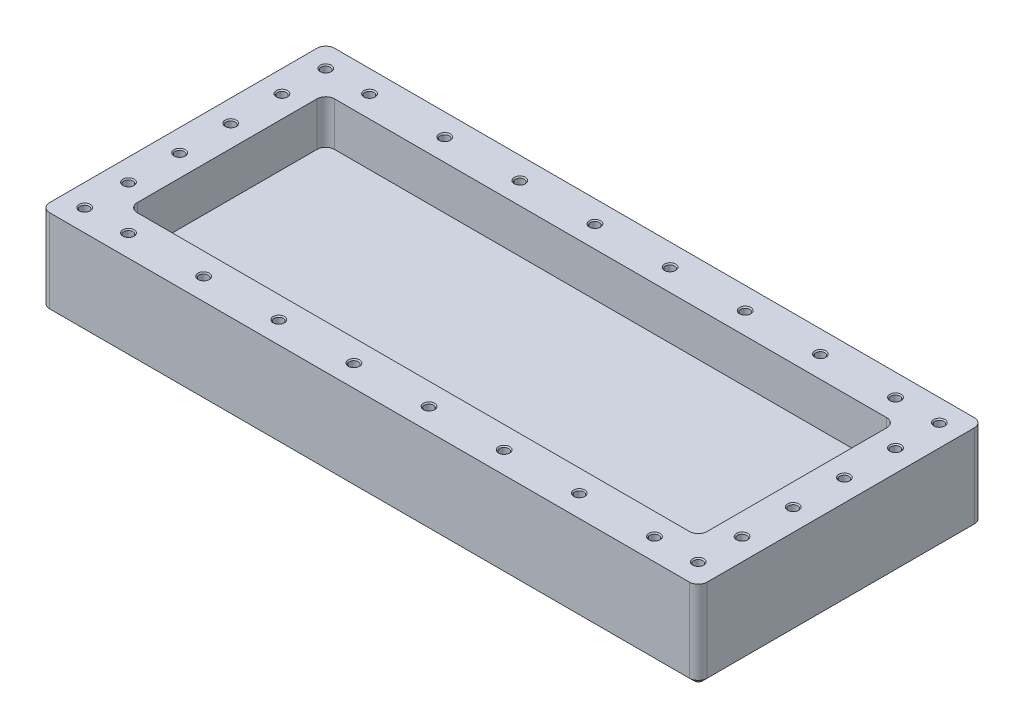
from build123d import *

# Parameters (mm, degrees)
SKETCH1_W                     = 150
SKETCH1_H                     = 65
BOSS_EXTRUDE1_DEPTH           = 20
SKETCH4_W                     = 130
SKETCH4_H                     = 45
CUT_EXTRUDE1_DEPTH            = 10
M2_5_TAPPED_HOLE1_D           = 2.05
M2_5_TAPPED_HOLE1_DEPTH       = 8
M2_5_TAPPED_HOLE1_CSINK_D     = 2.55
M2_5_TAPPED_HOLE1_CSINK_ANGLE = 90
M2_5_TAPPED_HOLE1_TIP         = 0.615882135
FILLET1_R                     = 2
FILLET2_R                     = 2
M2_5_TAPPED_HOLE2_D           = 2.05
M2_5_TAPPED_HOLE2_DEPTH       = 8
M2_5_TAPPED_HOLE2_CSINK_D     = 2.55
M2_5_TAPPED_HOLE2_CSINK_ANGLE = 90
M2_5_TAPPED_HOLE2_TIP         = 0.615882135
CHAMFER1_SIZE                 = 1


with BuildPart() as part:
    # Sketch1 → Boss-Extrude1 (new body)
    with BuildSketch(Plane(origin=(0, 0, 0), x_dir=(1, 0, 0), z_dir=(0, 1, 0))):
        Rectangle(SKETCH1_W, SKETCH1_H)
    extrude(amount=BOSS_EXTRUDE1_DEPTH)

    # Sketch3 → 1/8 NPT Tapped Hole1 (revolve, cut)
    with BuildSketch(Plane(origin=(60, 0, 0), x_dir=(0, 0, -1), z_dir=(1, 0, 0))):
        Polygon((0, 0), (0, 20), (4.2164, 20), (4.2164, 6.92), (4.537398933, 6.92), (4.744593, 0), align=None)
    revolve(axis=Axis((60, -6.35, 0), (0, 1, 0)), mode=Mode.SUBTRACT)

    # Sketch4 → Cut-Extrude1 (cut)
    with BuildSketch(Plane(origin=(0, 20, 0), x_dir=(1, 0, 0), z_dir=(0, 1, 0))):
        Rectangle(SKETCH4_W, SKETCH4_H)
    extrude(amount=-CUT_EXTRUDE1_DEPTH, mode=Mode.SUBTRACT)

    # M2.5 Tapped Hole1
    with Locations(Plane(origin=(-70, 20, -17.5), x_dir=(0, 0, 1), z_dir=(0, 1, 0))):
        with Locations((0, 0), (11.666666667, 0), (23.333333333, 0), (35, 0), (45, 10), (45, 27.142857143), (45, 44.285714286), (45, 61.428571429), (45, 78.571428571), (45, 95.714285714), (45, 112.857142857), (45, 130), (-10, 10), (-10, 27.142857143), (-10, 44.285714286), (-10, 61.428571429), (-10, 78.571428571), (-10, 95.714285714), (-10, 112.857142857), (-10, 130), (0, 140), (11.666666667, 140), (23.333333333, 140), (35, 140), (-10, 140), (45, 140), (-10, 0), (45, 0)):
            CounterSinkHole(M2_5_TAPPED_HOLE1_D / 2, M2_5_TAPPED_HOLE1_CSINK_D / 2, depth=M2_5_TAPPED_HOLE1_DEPTH, counter_sink_angle=M2_5_TAPPED_HOLE1_CSINK_ANGLE)
            with Locations((0, 0, -(M2_5_TAPPED_HOLE1_DEPTH + M2_5_TAPPED_HOLE1_TIP / 2))):  # 118° drill point
                Cone(0, M2_5_TAPPED_HOLE1_D / 2, M2_5_TAPPED_HOLE1_TIP, mode=Mode.SUBTRACT)

    # Fillet1
    fillet1_edges = [part.edges().sort_by_distance(p)[0] for p in [
        (-75, 10, -32.5),
        (75, 10, -32.5),
        (75, 10, 32.5),
        (-75, 10, 32.5),
    ]]
    fillet(fillet1_edges, radius=FILLET1_R)

    # Fillet2
    fillet2_edges = [part.edges().sort_by_distance(p)[0] for p in [
        (-65, 15, -22.5),
        (65, 15, -22.5),
        (65, 15, 22.5),
        (-65, 15, 22.5),
    ]]
    fillet(fillet2_edges, radius=FILLET2_R)

    # M2.5 Tapped Hole2
    with Locations(Plane(origin=(-42.75, 0, 7), x_dir=(0, 0, -1), z_dir=(0, -1, 0))):
        with Locations((0, 0), (0, 55.5), (14, 0), (14, 55.5)):
            CounterSinkHole(M2_5_TAPPED_HOLE2_D / 2, M2_5_TAPPED_HOLE2_CSINK_D / 2, depth=M2_5_TAPPED_HOLE2_DEPTH, counter_sink_angle=M2_5_TAPPED_HOLE2_CSINK_ANGLE)
            with Locations((0, 0, -(M2_5_TAPPED_HOLE2_DEPTH + M2_5_TAPPED_HOLE2_TIP / 2))):  # 118° drill point
                Cone(0, M2_5_TAPPED_HOLE2_D / 2, M2_5_TAPPED_HOLE2_TIP, mode=Mode.SUBTRACT)

    # Chamfer1
    chamfer1_edges = [part.edges().sort_by_distance(p)[0] for p in [
        (0, 0, -32.5),
        (-75, 0, 0),
        (75, 0, 0),
        (0, 0, 32.5),
        (-74.414213562, 0, -31.914213562),
        (-74.414213562, 0, 31.914213562),
        (74.414213562, 0, 31.914213562),
        (74.414213562, 0, -31.914213562),
    ]]
    chamfer(chamfer1_edges, length=CHAMFER1_SIZE)


solid = part.part
